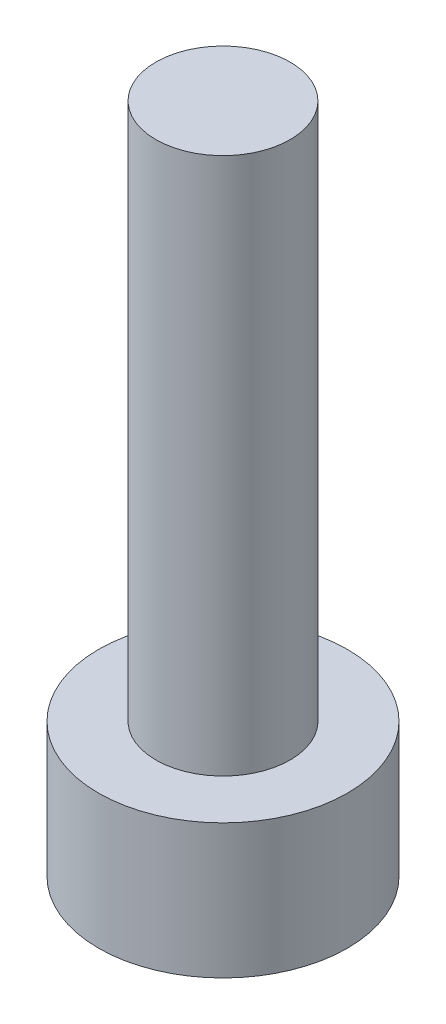
from build123d import *

# Parameters (mm, degrees)
SKETCH1_R           = 2.78
BOSS_EXTRUDE1_DEPTH = 3
SKETCH2_R           = 1.5
BOSS_EXTRUDE2_DEPTH = 12


with BuildPart() as part:
    # Sketch1 → Boss-Extrude1 (new body)
    with BuildSketch(Plane(origin=(0, 0, 0), x_dir=(1, 0, 0), z_dir=(0, 1, 0))):
        with Locations(Location((0, 0, 0), (0, 0, 270))):
            Circle(SKETCH1_R)
    extrude(amount=BOSS_EXTRUDE1_DEPTH)

    # Sketch2 → Boss-Extrude2 (add)
    with BuildSketch(Plane(origin=(0, 3, 0), x_dir=(1, 0, 0), z_dir=(0, 1, 0))):
        with Locations(Location((0, 0, 0), (0, 0, 270))):
            Circle(SKETCH2_R)
    extrude(amount=BOSS_EXTRUDE2_DEPTH)


solid = part.part
